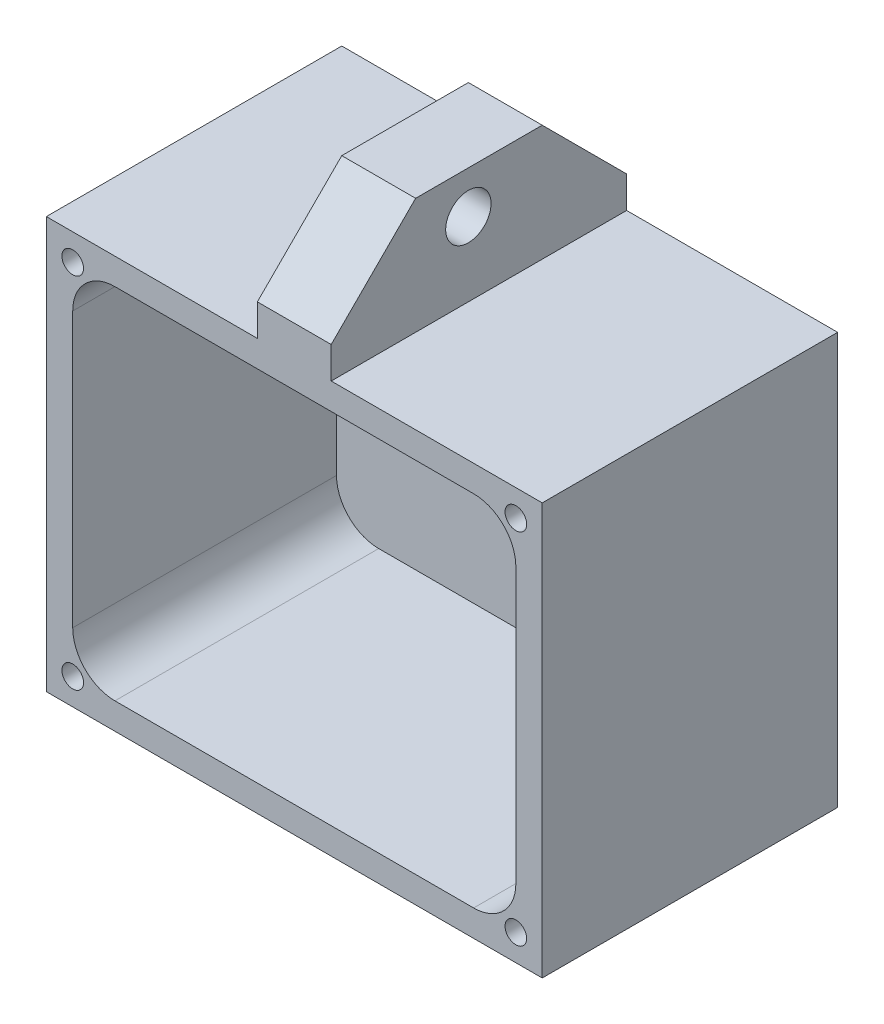
from build123d import *

# Parameters (mm, degrees)
SKETCH_1_W               = 47
SKETCH_1_H               = 39
EXTRUDE_1_DEPTH          = 28
SKETCH_4_W               = 42
SKETCH_4_H               = 34
CUT_EXTRUDE_1_DEPTH      = 25
FILLET_1_R               = 4
HOLE_WIZARD_M2_5_1_D     = 2.05
HOLE_WIZARD_M2_5_1_DEPTH = 6.35
HOLE_WIZARD_M2_5_1_TIP   = 0.615882135
HOLE_WIZARD_M3_1_D       = 2.5
CUT_EXTRUDE_2_REACH      = 41.465
SKETCH_10_R              = 6
SKETCH_11_W              = 7
SKETCH_11_H              = 11
EXTRUDE_2_DEPTH          = 28
HOLE_WIZARD_M4_1_D       = 4.3
CHAMFER_1_SIZE           = 8


with BuildPart() as part:
    # 草图1 → 凸台-拉伸1 (new body)
    with BuildSketch(Plane.XY):
        Rectangle(SKETCH_1_W, SKETCH_1_H)
    extrude(amount=EXTRUDE_1_DEPTH)

    # 草图4 → 切除-拉伸1 (cut)
    with BuildSketch(Plane.XY.offset(28)):
        Rectangle(SKETCH_4_W, SKETCH_4_H)
    extrude(amount=-CUT_EXTRUDE_1_DEPTH, mode=Mode.SUBTRACT)

    # 圆角1
    fillet_1_edges = [part.edges().sort_by_distance(p)[0] for p in [
        (-21, 17, 15.5),
        (-21, -17, 15.5),
        (21, -17, 15.5),
        (21, 17, 15.5),
    ]]
    fillet(fillet_1_edges, radius=FILLET_1_R)

    # M2.5 螺纹孔1
    with Locations(Plane.XY.offset(28)):
        with Locations((21, 17), (-21, -17), (-21, 17), (21, -17)):
            Hole(HOLE_WIZARD_M2_5_1_D / 2, depth=HOLE_WIZARD_M2_5_1_DEPTH)
            with Locations((0, 0, -(HOLE_WIZARD_M2_5_1_DEPTH + HOLE_WIZARD_M2_5_1_TIP / 2))):  # 118° drill point
                Cone(0, HOLE_WIZARD_M2_5_1_D / 2, HOLE_WIZARD_M2_5_1_TIP, mode=Mode.SUBTRACT)

    # M3 螺纹孔1 (through all)
    with Locations(Plane(origin=(0, 0, 0), x_dir=(-1, 0, 0), z_dir=(0, 0, -1))):
        with Locations((-12, -6.5), (12, -6.5), (0, 10.5)):
            Hole(HOLE_WIZARD_M3_1_D / 2)

    # 草图10 → 切除-拉伸2 (cut, up to next)
    with BuildSketch(Plane.XY.offset(3), mode=Mode.PRIVATE) as cut_extrude_2_sk1:
        Circle(SKETCH_10_R)
    cut_extrude_2_tool1 = extrude(cut_extrude_2_sk1.sketch, amount=-CUT_EXTRUDE_2_REACH, mode=Mode.PRIVATE) & part.part
    add(cut_extrude_2_tool1.solids().sort_by_distance((0, 0, 3))[0], mode=Mode.SUBTRACT)

    # 草图11 → 凸台-拉伸2 (add)
    with BuildSketch(Plane(origin=(0, 0, 0), x_dir=(-1, 0, 0), z_dir=(0, 0, -1))):
        with Locations((0, 25)):
            Rectangle(SKETCH_11_W, SKETCH_11_H)
    extrude(amount=-EXTRUDE_2_DEPTH)

    # M4 间隙孔1 (through all)
    with Locations(Plane(origin=(3.5, 0, 0), x_dir=(0, 0, -1), z_dir=(1, 0, 0))):
        with Locations((-15, 26.5)):
            Hole(HOLE_WIZARD_M4_1_D / 2)

    # 倒角1
    chamfer_1_edges = [part.edges().sort_by_distance(p)[0] for p in [
        (0, 30.5, 28),
        (0, 30.5, 0),
    ]]
    chamfer(chamfer_1_edges, length=CHAMFER_1_SIZE)


solid = part.part
